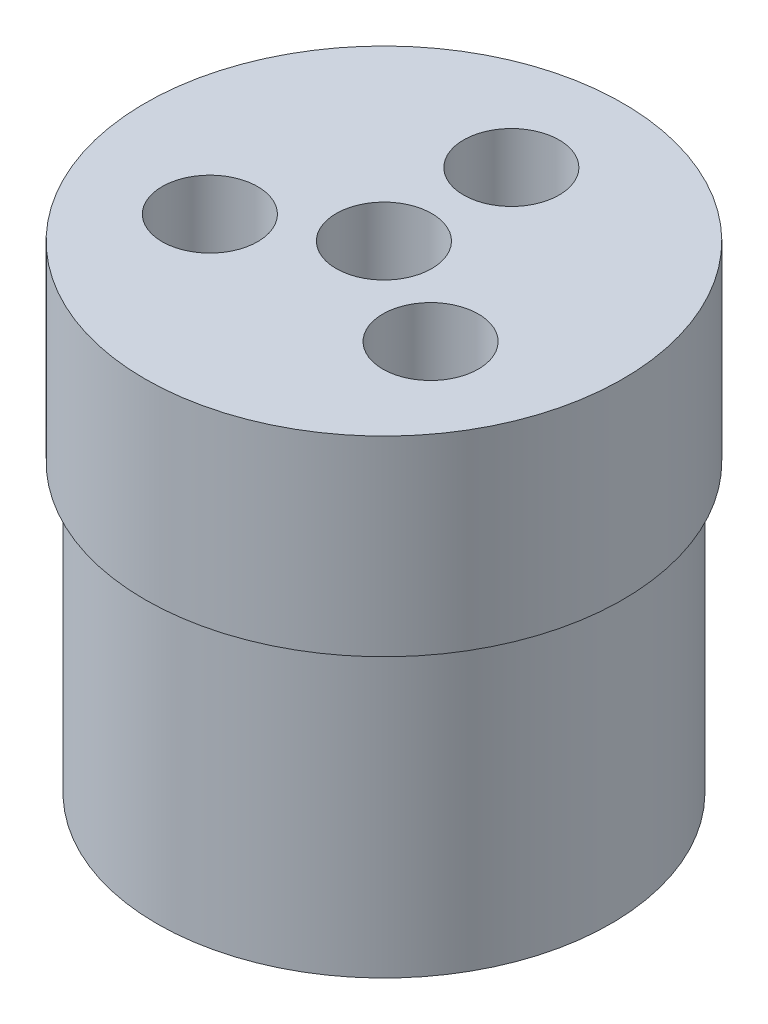
from build123d import *

# Parameters (mm, degrees)
SKETCH_1_R               = 14.25
EXTRUDE_1_DEPTH          = 15
HOLE_WIZARD_6_0_6_1_D    = 6
HOLE_WIZARD_6_0_6_2_D    = 6
PATTERN_CIRCULAR_1_COUNT = 3
SKETCH_6_R               = 15
SKETCH_6_R_2             = 14.25
EXTRUDE_2_DEPTH          = 12


with BuildPart() as part:
    # 스케치1 → 보스-돌출1 (new, symmetric)
    with BuildSketch(Plane(origin=(0, 0, 0), x_dir=(1, 0, 0), z_dir=(0, 1, 0))):
        with Locations(Location((0, 0, 0), (0, 0, 270))):
            Circle(SKETCH_1_R)
    extrude(amount=EXTRUDE_1_DEPTH, both=True)

    # Ø6.0 (6) 지름 구멍1 (through all)
    with Locations(Plane(origin=(0, 15, 0), x_dir=(1, 0, 0), z_dir=(0, 1, 0))):
        with Locations((0, 0)):
            Hole(HOLE_WIZARD_6_0_6_1_D / 2)

    # Ø6.0 (6) 지름 구멍2 (through all)
    with Locations(Plane(origin=(0, 15, 0), x_dir=(1, 0, 0), z_dir=(0, 1, 0))):
        with Locations((0, 8)):
            hole_wizard_6_0_6_2 = Hole(HOLE_WIZARD_6_0_6_2_D / 2)

    # 원형 패턴1: Ø6.0 (6) 지름 구멍2 ×3 about axis
    pattern_circular_1_axis = Axis((0, 0, 0), (0, 1, 0))
    for i in range(1, PATTERN_CIRCULAR_1_COUNT):
        add(hole_wizard_6_0_6_2.rotate(pattern_circular_1_axis, i * 360 / PATTERN_CIRCULAR_1_COUNT), mode=Mode.SUBTRACT)

    # 스케치6 → 보스-돌출2 (add)
    with BuildSketch(Plane(origin=(0, 15, 0), x_dir=(1, 0, 0), z_dir=(0, 1, 0))):
        with Locations(Location((0, 0, 0), (0, 0, 270))):
            Circle(SKETCH_6_R)
        with Locations(Location((0, 0, 0), (0, 0, 270))):
            Circle(SKETCH_6_R_2, mode=Mode.SUBTRACT)
    extrude(amount=-EXTRUDE_2_DEPTH)


solid = part.part
